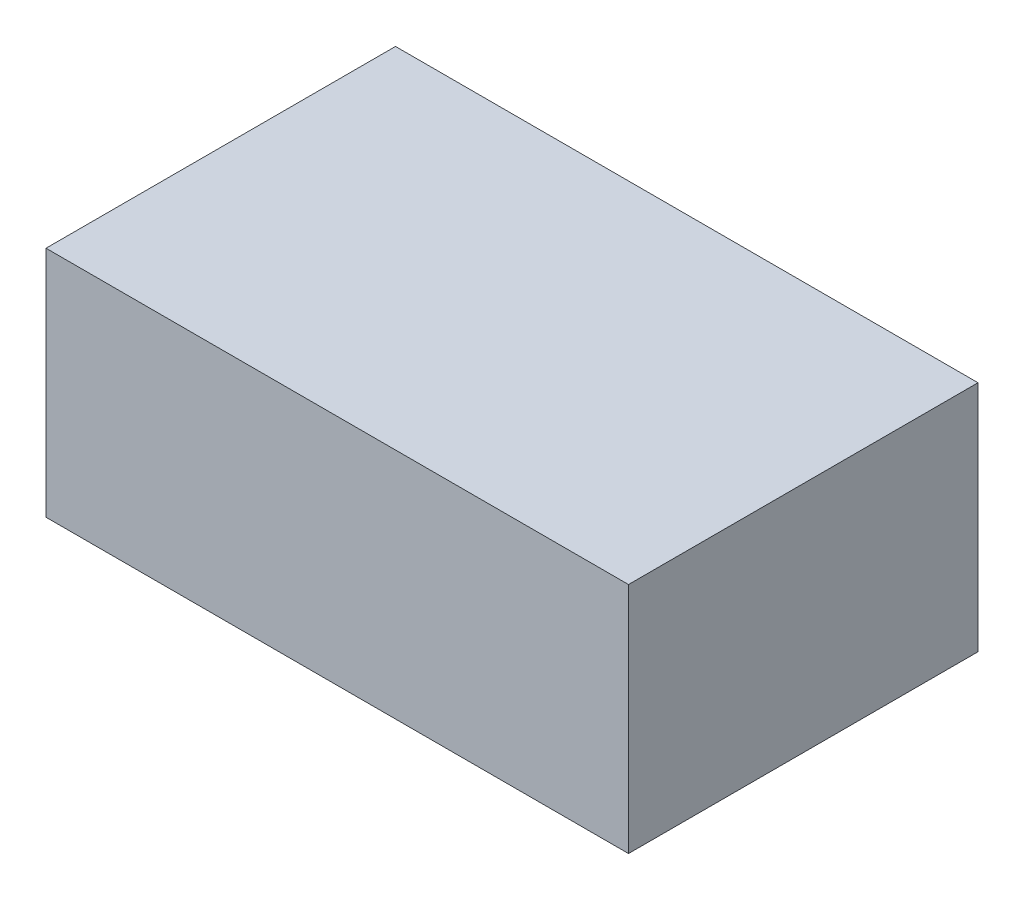
from build123d import *

# Parameters (mm, degrees)
ESQUISSE1_W        = 250
ESQUISSE1_H        = 150
BOSS_EXTRU_1_DEPTH = 100


with BuildPart() as part:
    # Esquisse1 → Boss.-Extru.1 (new body)
    with BuildSketch(Plane(origin=(0, 0, 0), x_dir=(1, 0, 0), z_dir=(0, 1, 0))):
        Rectangle(ESQUISSE1_W, ESQUISSE1_H)
    extrude(amount=BOSS_EXTRU_1_DEPTH)


solid = part.part
